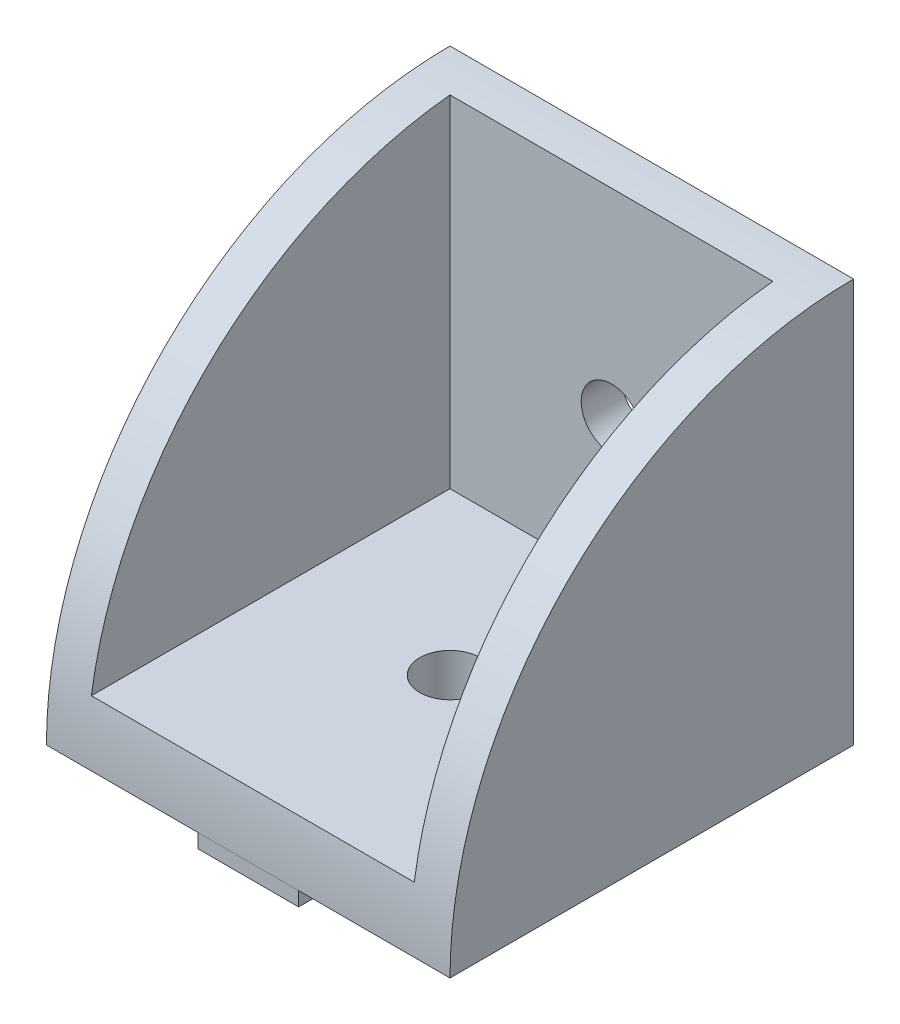
from build123d import *

# Parameters (mm, degrees)
SKETCH_1_W          = 20
SKETCH_1_H          = 20
REVOLVE_1_ANGLE     = 90
SKETCH_2_W          = 16
SKETCH_2_H          = 18
CUT_EXTRUDE_1_DEPTH = 30
SKETCH_3_W          = 16
SKETCH_3_H          = 18
EXTRUDE_1_DEPTH     = 3
SKETCH_4_R          = 21
SKETCH_4_R_2        = 20
CUT_EXTRUDE_2_DEPTH = 35.641016151
SKETCH_5_R          = 1.5
CUT_EXTRUDE_3_DEPTH = 35.641016151
SKETCH_6_W          = 5
SKETCH_6_H          = 20
EXTRUDE_2_DEPTH     = 0.7
SKETCH_7_R          = 1.5
CUT_EXTRUDE_4_DEPTH = 100


with BuildPart() as part:
    # Эскиз1 → Повернуть1 (revolve)
    with BuildSketch(Plane.XY):
        with Locations((10, 10)):
            Rectangle(SKETCH_1_W, SKETCH_1_H)
    revolve(axis=Axis((0, 0, 0), (1, 0, 0)), revolution_arc=REVOLVE_1_ANGLE)

    # Эскиз2 → Вырез-Вытянуть1 (cut)
    with BuildSketch(Plane.XZ):
        with Locations((10, 11)):
            Rectangle(SKETCH_2_W, SKETCH_2_H)
    extrude(amount=-CUT_EXTRUDE_1_DEPTH, mode=Mode.SUBTRACT)

    # Эскиз3 → Бобышка-Вытянуть1 (add)
    with BuildSketch(Plane.XZ):
        with Locations((10, 11)):
            Rectangle(SKETCH_3_W, SKETCH_3_H)
    extrude(amount=-EXTRUDE_1_DEPTH)

    # Эскиз4 → Вырез-Вытянуть2 (cut, through all)
    with BuildSketch(Plane.ZY):
        Circle(SKETCH_4_R)
        Circle(SKETCH_4_R_2, mode=Mode.SUBTRACT)
    extrude(amount=-CUT_EXTRUDE_2_DEPTH, mode=Mode.SUBTRACT)

    # Эскиз5 → Вырез-Вытянуть3 (cut, through all)
    with BuildSketch(Plane(origin=(0, 0, 0), x_dir=(-1, 0, 0), z_dir=(0, 0, -1))):
        with Locations((-10, 10)):
            Circle(SKETCH_5_R)
    extrude(amount=-CUT_EXTRUDE_3_DEPTH, mode=Mode.SUBTRACT)

    # Эскиз6 → Бобышка-Вытянуть2 (add)
    with BuildSketch(Plane.XZ):
        with Locations((10, 10)):
            Rectangle(SKETCH_6_W, SKETCH_6_H)
    extrude(amount=EXTRUDE_2_DEPTH)

    # Эскиз7 → Вырез-Вытянуть4 (cut)
    with BuildSketch(Plane.XZ.offset(0.7)):
        with Locations(Location((10, 10, 0), (0, 0, 270))):
            Circle(SKETCH_7_R)
    extrude(amount=-CUT_EXTRUDE_4_DEPTH, mode=Mode.SUBTRACT)


solid = part.part
